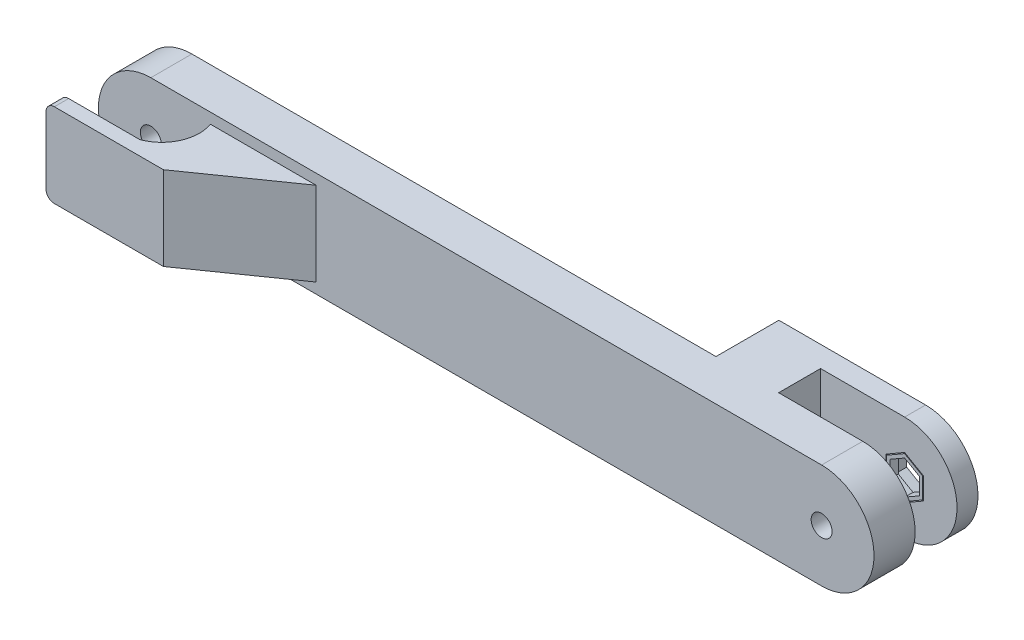
from build123d import *

# Parameters (mm, degrees)
SKETCH1_R            = 3.175
BOSS_EXTRUDE1_DEPTH  = 12.446
BOSS_EXTRUDE8_DEPTH  = 19.05
CUT_EXTRUDE3_DEPTH   = 41.148
BOSS_EXTRUDE9_DEPTH  = 25.4
BOSS_EXTRUDE10_START = 19.05
BOSS_EXTRUDE10_DEPTH = 19.05
SKETCH11_W           = 41.338406503
SKETCH11_H           = 12.7
CUT_EXTRUDE4_DEPTH   = 35.56
BOSS_EXTRUDE11_DEPTH = 2.54


with BuildPart() as part:
    # Sketch1 → Boss-Extrude1 (new body)
    with BuildSketch(Plane.XY):
        with BuildLine():
            Line((299.870251741, -63.185614448), (503.070251741, -63.185614448))
            ThreePointArc((503.070251741, -63.185614448), (518.945251741, -79.060614448), (503.070251741, -94.935614448))
            Line((503.070251741, -94.935614448), (299.870251741, -94.935614448))
            ThreePointArc((299.870251741, -94.935614448), (283.995251741, -79.060614448), (299.870251741, -63.185614448))
        make_face()
        with Locations((299.870251741, -79.060614448)):
            Circle(SKETCH1_R, mode=Mode.SUBTRACT)
        with Locations((503.070251741, -79.060614448)):
            Circle(SKETCH1_R, mode=Mode.SUBTRACT)
    extrude(amount=BOSS_EXTRUDE1_DEPTH)

    # Sketch7 → Boss-Extrude8 (add)
    with BuildSketch(Plane.XY.offset(12.446)):
        with BuildLine():
            Line((310.030251741, -66.360614448), (312.570251741, -66.360614448))
            Line((312.570251741, -66.360614448), (322.730251741, -66.360614448))
            Line((322.730251741, -66.360614448), (322.730251741, -91.760614448))
            Line((322.730251741, -91.760614448), (310.030251741, -91.760614448))
            Line((310.030251741, -91.760614448), (289.710251741, -91.760614448))
            ThreePointArc((289.710251741, -91.760614448), (287.914200517, -91.016665672), (287.170251741, -89.220614448))
            Line((287.170251741, -89.220614448), (287.170251741, -68.900614448))
            ThreePointArc((287.170251741, -68.900614448), (287.914200517, -67.104563223), (289.710251741, -66.360614448))
            Line((289.710251741, -66.360614448), (310.030251741, -66.360614448))
        make_face()
    extrude(amount=BOSS_EXTRUDE8_DEPTH)

    # Sketch8 → Cut-Extrude3 (cut)
    with BuildSketch(Plane(origin=(0, -66.360614448, 0), x_dir=(1, 0, 0), z_dir=(0, 1, 0))):
        with BuildLine():
            Line((287.170251741, -12.446), (317.904251741, -12.446))
            ThreePointArc((317.904251741, -12.446), (317.648023156, -21.177345807), (311.300251741, -27.178))
            Line((311.300251741, -27.178), (287.170251741, -27.178))
            Line((287.170251741, -27.178), (287.170251741, -12.446))
        make_face()
    extrude(amount=-CUT_EXTRUDE3_DEPTH, mode=Mode.SUBTRACT)

    # Sketch9 → Boss-Extrude9 (add)
    with BuildSketch(Plane(origin=(0, -66.360614448, 0), x_dir=(1, 0, 0), z_dir=(0, 1, 0))):
        Polygon((322.730251741, -31.496), (349.936471269, -12.446), (322.730251741, -12.446), align=None)
    extrude(amount=-BOSS_EXTRUDE9_DEPTH)

    # Sketch10 → Boss-Extrude10 (add)
    with BuildSketch(Plane(origin=(0, 0, 0), x_dir=(-1, 0, 0), z_dir=(0, 0, -1)).offset(BOSS_EXTRUDE10_START)):
        with BuildLine():
            Line((-503.070251741, -94.935614448), (-458.620251741, -94.935614448))
            Line((-458.620251741, -94.935614448), (-458.620251741, -63.185614448))
            Line((-458.620251741, -63.185614448), (-503.070251741, -63.185614448))
            ThreePointArc((-503.070251741, -63.185614448), (-518.945251741, -79.060614448), (-503.070251741, -94.935614448))
        make_face()
        Polygon((-503.070251741, -72.461500871), (-508.785251741, -75.761057659), (-508.785251741, -82.360171236), (-503.070251741, -85.659728024), (-497.355251741, -82.360171236), (-497.355251741, -75.761057659), align=None, mode=Mode.SUBTRACT)
    extrude(amount=-BOSS_EXTRUDE10_DEPTH)

    # Sketch11 → Cut-Extrude4 (cut)
    with BuildSketch(Plane(origin=(0, -63.185614448, 0), x_dir=(1, 0, 0), z_dir=(0, 1, 0))):
        with Locations((498.276048489, 6.35)):
            Rectangle(SKETCH11_W, SKETCH11_H)
    extrude(amount=-CUT_EXTRUDE4_DEPTH, mode=Mode.SUBTRACT)


with BuildPart() as body_2:
    # Sketch13 → Boss-Extrude11 (new body)
    with BuildSketch(Plane(origin=(0, 0, -12.7), x_dir=(-1, 0, 0), z_dir=(0, 0, -1))):
        Polygon((-503.070251741, -72.776791853), (-508.512201741, -75.91870315), (-508.512201741, -82.202525745), (-503.070251741, -85.344437042), (-497.628301741, -82.202525745), (-497.628301741, -75.91870315), align=None)
        Polygon((-503.070251741, -73.924110105), (-507.518594988, -76.492362276), (-507.518594988, -81.628866619), (-503.070251741, -84.19711879), (-498.621908494, -81.628866619), (-498.621908494, -76.492362276), align=None, mode=Mode.SUBTRACT)
    extrude(amount=BOSS_EXTRUDE11_DEPTH)


solid = Compound([part.part, body_2.part])
